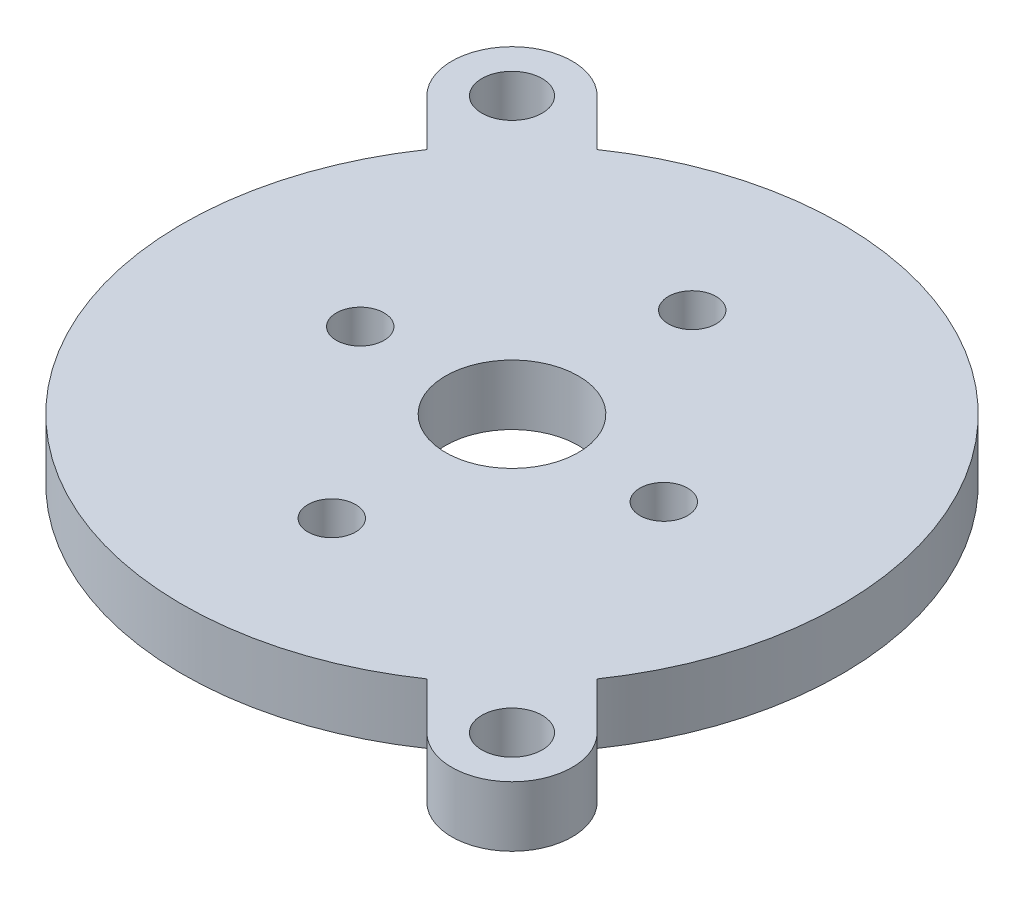
from build123d import *

# Parameters (mm, degrees)
SKETCH3_R           = 1.2573
CUT_EXTRUDE1_DEPTH  = 25.781842813
SKETCH4_R           = 3.175
SKETCH4_R_2         = 1.5875
BOSS_EXTRUDE1_DEPTH = 3.175


with BuildPart() as part:
    # Sketch1 → Revolve1 (revolve)
    with BuildSketch(Plane.XY, mode=Mode.PRIVATE) as revolve1_sk:
        Polygon((17.3789975, 3.175), (17.3789975, 0), (3.5, 0), (3.5, 3.175), (14.2039975, 3.175), align=None)
    revolve(revolve1_sk.sketch.rotate(Axis((0, 0, 0), (0, 1, 0)), 90), axis=Axis((0, 0, 0), (0, 1, 0)))

    # Sketch3 → Cut-Extrude1 (cut, through all)
    with BuildSketch(Plane(origin=(0, 3.175, 0), x_dir=(1, 0, 0), z_dir=(0, 1, 0))):
        with Locations(Location((0, -9.5, 0), (0, 0, 270))):
            Circle(SKETCH3_R)
        with Locations(Location((-8.000000002, 0, 0), (0, 0, 270))):
            Circle(SKETCH3_R)
        with Locations(Location((0, 9.5, 0), (0, 0, 270))):
            Circle(SKETCH3_R)
        with Locations(Location((8.000000002, 0, 0), (0, 0, 270))):
            Circle(SKETCH3_R)
    extrude(amount=-CUT_EXTRUDE1_DEPTH, mode=Mode.SUBTRACT)

    # Sketch4 → Boss-Extrude1 (add)
    # profile 1 of 6: a face of its own
    with BuildSketch(Plane(origin=(0, 0, 0), x_dir=(1, 0, 0), z_dir=(0, 1, 0))):
        with Locations((-14.533871013, 14.533871013)):
            Circle(SKETCH4_R)
        with Locations(Location((-14.533871013, 14.533871013, 0), (0, 0, 270))):
            Circle(SKETCH4_R_2, mode=Mode.SUBTRACT)
    # profile 2 of 6: a face of its own
    with BuildSketch(Plane(origin=(0, 0, 0), x_dir=(1, 0, 0), z_dir=(0, 1, 0))):
        with BuildLine():
            ThreePointArc((-12.288807066, 12.288806898), (-11.109708346, 13.364278303), (-9.836925233, 14.327053293))
            Line((-9.836925233, 14.327053293), (-12.288806982, 16.778935043))
            ThreePointArc((-12.288806982, 16.778935043), (-11.600553497, 15.74889091), (-11.358871013, 14.533871013))
            ThreePointArc((-11.358871013, 14.533871013), (-11.60055352, 13.31885106), (-12.288807066, 12.288806899))
        make_face()
    # profile 3 of 6: a face of its own
    with BuildSketch(Plane(origin=(0, 0, 0), x_dir=(1, 0, 0), z_dir=(0, 1, 0))):
        with BuildLine():
            ThreePointArc((-14.327053293, 9.836925233), (-13.364278379, 11.109708255), (-12.288807066, 12.288806898))
            ThreePointArc((-12.288807066, 12.288806899), (-14.533871072, 11.358871013), (-16.778935043, 12.288806982))
            Line((-16.778935043, 12.288806982), (-14.327053293, 9.836925233))
        make_face()
    # profile 4 of 6: a face of its own
    with BuildSketch(Plane(origin=(0, 0, 0), x_dir=(1, 0, 0), z_dir=(0, 1, 0))):
        with Locations((14.533871013, -14.533871013)):
            Circle(SKETCH4_R)
        with Locations(Location((14.533871013, -14.533871013, 0), (0, 0, 270))):
            Circle(SKETCH4_R_2, mode=Mode.SUBTRACT)
    # profile 5 of 6: a face of its own
    with BuildSketch(Plane(origin=(0, 0, 0), x_dir=(1, 0, 0), z_dir=(0, 1, 0))):
        with BuildLine():
            ThreePointArc((12.288806982, -16.778935043), (11.358871013, -14.533870968), (12.288807046, -12.288806919))
            ThreePointArc((12.288807046, -12.288806919), (11.109708335, -13.364278313), (9.836925233, -14.327053293))
            Line((9.836925233, -14.327053293), (12.288806982, -16.778935043))
        make_face()
    # profile 6 of 6: a face of its own
    with BuildSketch(Plane(origin=(0, 0, 0), x_dir=(1, 0, 0), z_dir=(0, 1, 0))):
        with BuildLine():
            ThreePointArc((12.288807046, -12.288806919), (14.533871058, -11.358871013), (16.778935043, -12.288806982))
            Line((16.778935043, -12.288806982), (14.327053293, -9.836925233))
            ThreePointArc((14.327053293, -9.836925233), (13.36427837, -11.109708266), (12.288807046, -12.288806919))
        make_face()
    extrude(amount=BOSS_EXTRUDE1_DEPTH)


solid = part.part
